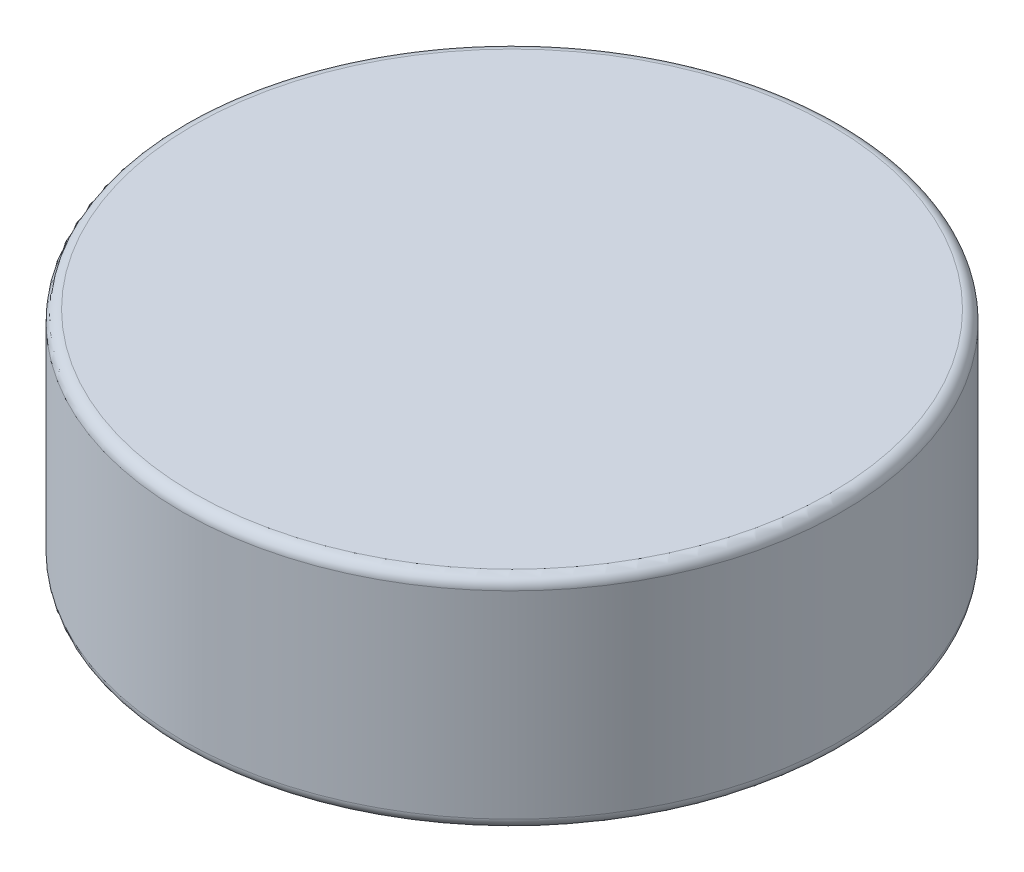
from build123d import *

# Parameters (mm, degrees)
SKETCH1_R           = 15
BOSS_EXTRUDE1_DEPTH = 10
FILLET1_R           = 0.5


with BuildPart() as part:
    # Sketch1 → Boss-Extrude1 (new body)
    with BuildSketch(Plane(origin=(0, 0, 0), x_dir=(1, 0, 0), z_dir=(0, 1, 0))):
        with Locations(Location((0, 0, 0), (0, 0, 270))):
            Circle(SKETCH1_R)
    extrude(amount=BOSS_EXTRUDE1_DEPTH)

    # Fillet1
    fillet1_edges = [part.edges().sort_by_distance(p)[0] for p in [
        (0, 0, -15),
        (0, 10, -15),
    ]]
    fillet(fillet1_edges, radius=FILLET1_R)


solid = part.part
